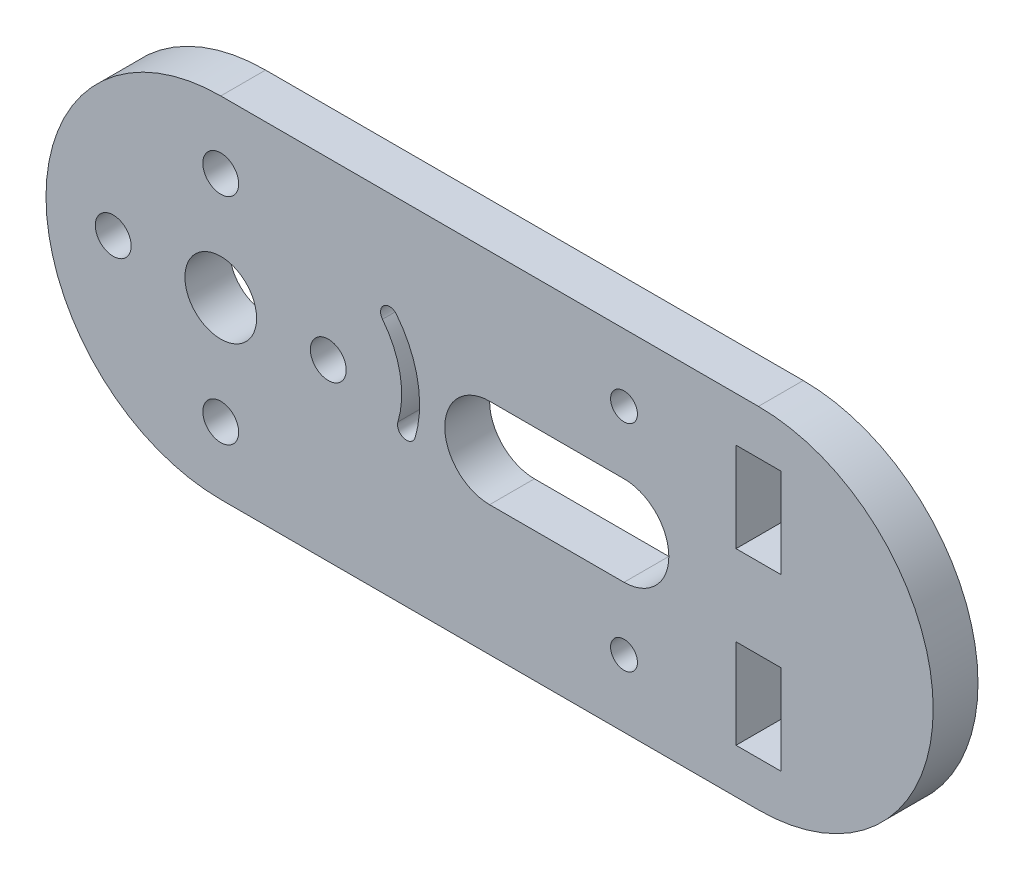
from build123d import *

# Parameters (mm, degrees)
SKETCH1_R           = 2
SKETCH1_R_2         = 4
SKETCH1_R_3         = 1.5
SKETCH1_W           = 5
SKETCH1_H           = 10
BOSS_EXTRUDE1_DEPTH = 5


with BuildPart() as part:
    # Sketch1 → Boss-Extrude1 (new body)
    with BuildSketch(Plane.XY):
        with BuildLine():
            Line((-30, 19.5), (30, 19.5))
            ThreePointArc((30, 19.5), (49.5, 0), (30, -19.5))
            Line((30, -19.5), (-30, -19.5))
            ThreePointArc((-30, -19.5), (-49.5, 0), (-30, 19.5))
        make_face()
        with Locations((-30, 12)):
            Circle(SKETCH1_R, mode=Mode.SUBTRACT)
        with Locations((-18, 0)):
            Circle(SKETCH1_R, mode=Mode.SUBTRACT)
        with Locations((-30, -12)):
            Circle(SKETCH1_R, mode=Mode.SUBTRACT)
        with Locations((-42, 0)):
            Circle(SKETCH1_R, mode=Mode.SUBTRACT)
        with Locations((-30, 0)):
            Circle(SKETCH1_R_2, mode=Mode.SUBTRACT)
        with Locations((15, 12)):
            Circle(SKETCH1_R_3, mode=Mode.SUBTRACT)
        with Locations((15, -12)):
            Circle(SKETCH1_R_3, mode=Mode.SUBTRACT)
        with BuildLine():
            Line((15, -5), (0, -5))
            ThreePointArc((0, -5), (-5, 0), (0, 5))
            Line((0, 5), (15, 5))
            ThreePointArc((15, 5), (20, 0), (15, -5))
        make_face(mode=Mode.SUBTRACT)
        with Locations((30, 9.5)):
            Rectangle(SKETCH1_W, SKETCH1_H, mode=Mode.SUBTRACT)
        with Locations((30, -9.5)):
            Rectangle(SKETCH1_W, SKETCH1_H, mode=Mode.SUBTRACT)
        with BuildLine():
            ThreePointArc((-11.950316083, 6.944527868), (-11.782969997, 8.348805364), (-10.3786925, 8.181459278))
            ThreePointArc((-10.3786925, 8.181459278), (-8.018515434, 2.995451326), (-8.316401238, -2.694573131))
            ThreePointArc((-8.316401238, -2.694573131), (-9.561940964, -3.364372198), (-10.231740032, -2.118832472))
            ThreePointArc((-10.231740032, -2.118832472), (-9.983501861, 2.622854574), (-11.950316083, 6.944527868))
        make_face(mode=Mode.SUBTRACT)
    extrude(amount=BOSS_EXTRUDE1_DEPTH)


solid = part.part
